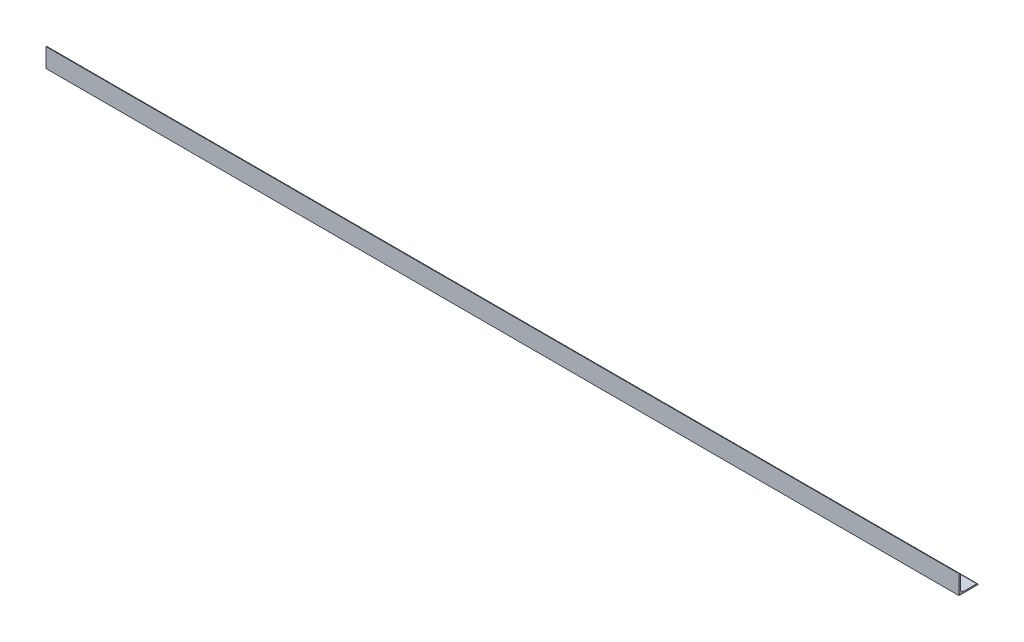
from build123d import *

# Parameters (mm, degrees)
L_ANGLE_EQUAL_40X40X3_2_DEPTH = 1920
SKETCH15_R                    = 2
CUT_EXTRUDE1_DEPTH            = 10


with BuildPart() as part:
    # Sketch13 → L angle (equal) 40X40X3(2) (new body)
    with BuildSketch(Plane(origin=(0, 0, 0), x_dir=(0, 0, -1), z_dir=(1, 0, 0))):
        with BuildLine():
            Line((0, 40), (0, 0))
            Line((0, 0), (40, 0))
            ThreePointArc((40, 0), (39.121320344, 2.121320344), (37, 3))
            Line((37, 3), (9, 3))
            ThreePointArc((9, 3), (4.757359313, 4.757359313), (3, 9))
            Line((3, 9), (3, 37))
            ThreePointArc((3, 37), (2.121320344, 39.121320344), (0, 40))
        make_face()
    extrude(amount=L_ANGLE_EQUAL_40X40X3_2_DEPTH)

    # Sketch15 → Cut-Extrude1 (cut)
    with BuildSketch(Plane(origin=(0, 0, 0), x_dir=(-1, 0, 0), z_dir=(0, -1, 0))):
        with Locations(Location((-960, 20, 0), (0, 0, 90))):
            Circle(SKETCH15_R)
        with Locations(Location((-470, 20, 0), (0, 0, 90))):
            Circle(SKETCH15_R)
        with Locations(Location((-1450, 20, 0), (0, 0, 90))):
            Circle(SKETCH15_R)
    extrude(amount=-CUT_EXTRUDE1_DEPTH, mode=Mode.SUBTRACT)


solid = part.part
